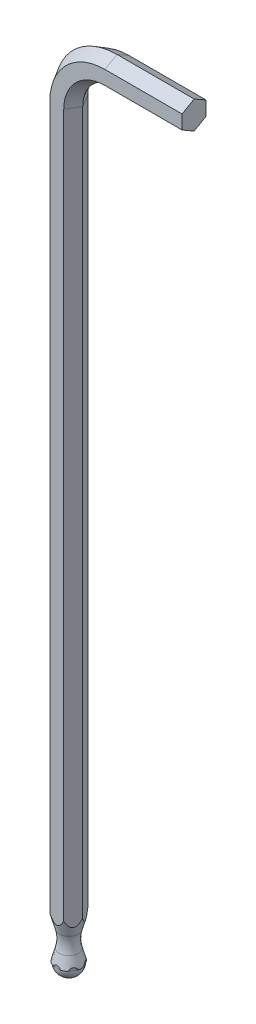
from build123d import *


with BuildPart() as part:
    # Austragung4: sweep along a path in Skizze1
    with BuildLine(Plane.XY) as austragung4_path:
        Line((0, 0), (0, 155))
        ThreePointArc((0, 155), (2.928932188, 162.071067812), (10, 165))
        Line((10, 165), (26, 165))
    # Skizze3 → Austragung4 (sweep)
    with BuildSketch(Plane(origin=(0, 0, 0), x_dir=(1, 0, 0), z_dir=(0, 1, 0))):
        Polygon((-1.443375673, 2.5), (-2.886751346, 0), (-1.443375673, -2.5), (1.443375673, -2.5), (2.886751346, 0), (1.443375673, 2.5), align=None)
    sweep(path=austragung4_path.line)

    # Skizze6 → Rotation5 (revolve)
    with BuildSketch(Plane(origin=(0, 0, 0), x_dir=(0, 0, -1), z_dir=(1, 0, 0))):
        with BuildLine():
            Line((0, -2.5), (0, 2.5))
            ThreePointArc((0, 2.5), (2.5, 0), (0, -2.5))
        make_face()
    revolve(axis=Axis((0, 7.810357944, 0), (0, -1, 0)))

    # Skizze8 → Schnitt-Rotation1 (revolve, cut)
    with BuildSketch(Plane.XY, mode=Mode.PRIVATE) as schnitt_rotation1_sk:
        with BuildLine():
            Line((-2.886751346, -0.9), (-1.981812629, 2.362800933))
            ThreePointArc((-1.981812629, 2.362800933), (-1.745369079, 4.1), (-1.981812629, 5.837199067))
            Line((-1.981812629, 5.837199067), (-2.886751346, 9.1))
            Line((-2.886751346, 9.1), (-2.886751346, -0.9))
        make_face()
    revolve(schnitt_rotation1_sk.sketch.rotate(Axis((0, 0, 0), (0, 1, 0)), 270), axis=Axis((0, 0, 0), (0, 1, 0)), mode=Mode.SUBTRACT)


solid = part.part
